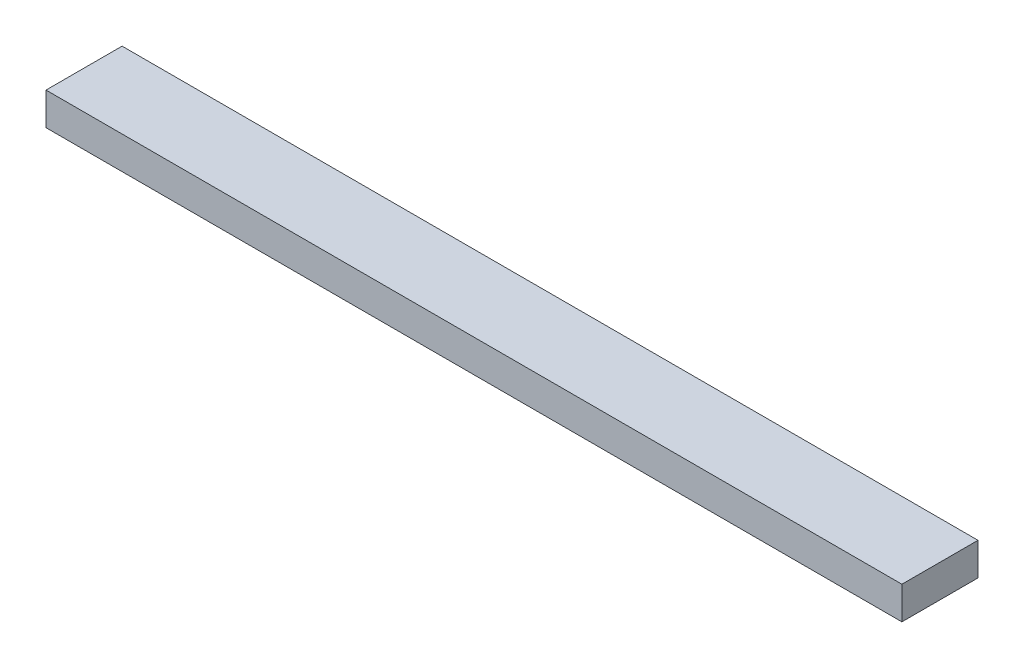
from build123d import *

# Parameters (mm, degrees)
SKETCH1_W           = 1000
SKETCH1_H           = 88.9
BOSS_EXTRUDE1_DEPTH = 38.1


with BuildPart() as part:
    # Sketch1 → Boss-Extrude1 (new body)
    with BuildSketch(Plane(origin=(0, 0, 0), x_dir=(1, 0, 0), z_dir=(0, 1, 0))):
        with Locations((500, 44.45)):
            Rectangle(SKETCH1_W, SKETCH1_H)
    extrude(amount=BOSS_EXTRUDE1_DEPTH)


solid = part.part
